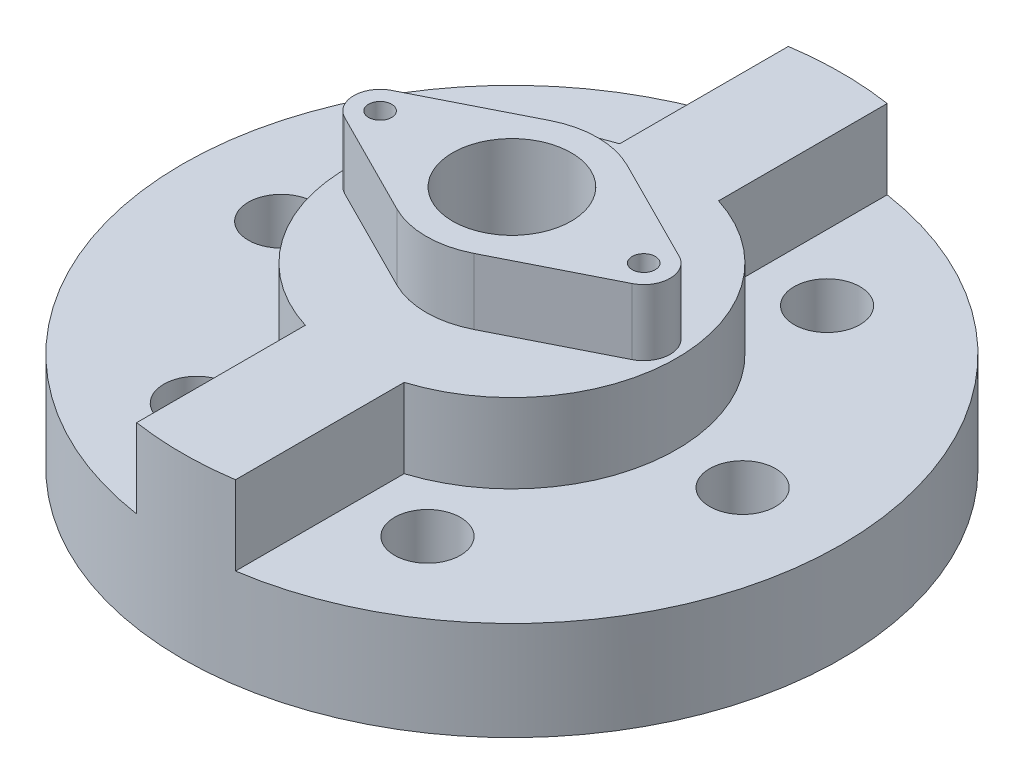
from build123d import *
from build123d.topology import SkipClean

# Parameters (mm, degrees)
SKETCH1_R           = 50
BOSS_EXTRUDE1_DEPTH = 15
BOSS_EXTRUDE2_DEPTH = 12
SKETCH3_R           = 1.75
BOSS_EXTRUDE3_DEPTH = 10
HOLE1_D             = 18
HOLE2_D             = 10
CIRPATTERN1_COUNT   = 6


with BuildPart() as part:
    # Sketch1 → Boss-Extrude1 (new body)
    with BuildSketch(Plane(origin=(0, 0, 0), x_dir=(1, 0, 0), z_dir=(0, 1, 0))):
        with Locations(Location((0, 0, 0), (0, 0, 270))):
            Circle(SKETCH1_R)
    extrude(amount=BOSS_EXTRUDE1_DEPTH)

    # Sketch2 → Boss-Extrude2 (add)
    with SkipClean():  # the faces are left unmerged after this step: merging them gives an invalid solid
        with BuildSketch(Plane(origin=(0, 15, 0), x_dir=(1, 0, 0), z_dir=(0, 1, 0))):
            with BuildLine():
                Line((7.5, 49.434299833), (7.5, 23.848480035))
                ThreePointArc((7.5, 23.848480035), (25, 0), (7.5, -23.848480035))
                Line((7.5, -23.848480035), (7.5, -49.434299833))
                ThreePointArc((7.5, -49.434299833), (0, -50), (-7.5, -49.434299833))
                Line((-7.5, -49.434299833), (-7.5, -23.848480035))
                ThreePointArc((-7.5, -23.848480035), (-25, 0), (-7.5, 23.848480035))
                Line((-7.5, 23.848480035), (-7.5, 49.434299833))
                ThreePointArc((-7.5, 49.434299833), (0, 50), (7.5, 49.434299833))
            make_face()
        extrude(amount=BOSS_EXTRUDE2_DEPTH)

    # Sketch3 → Boss-Extrude3 (add)
    with SkipClean():  # the faces are left unmerged after this step: merging them gives an invalid solid
        with BuildSketch(Plane(origin=(0, 27, 0), x_dir=(1, 0, 0), z_dir=(0, 1, 0))):
            with BuildLine():
                Line((-21.8, 3.57211422), (-5.85, 11.609371215))
                ThreePointArc((-5.85, 11.609371215), (0, 13), (5.85, 11.609371215))
                Line((5.85, 11.609371215), (21.8, 3.57211422))
                ThreePointArc((21.8, 3.57211422), (24, 0), (21.8, -3.57211422))
                Line((21.8, -3.57211422), (5.85, -11.609371215))
                ThreePointArc((5.85, -11.609371215), (0, -13), (-5.85, -11.609371215))
                Line((-5.85, -11.609371215), (-21.8, -3.57211422))
                ThreePointArc((-21.8, -3.57211422), (-24, 0), (-21.8, 3.57211422))
            make_face()
            with Locations(Location((-20, 0, 0), (0, 0, 270))):
                Circle(SKETCH3_R, mode=Mode.SUBTRACT)
            with Locations(Location((20, 0, 0), (0, 0, 270))):
                Circle(SKETCH3_R, mode=Mode.SUBTRACT)
        extrude(amount=BOSS_EXTRUDE3_DEPTH)

    # Hole1 (through all)
    with Locations(Plane(origin=(0, 37, 0), x_dir=(1, 0, 0), z_dir=(0, 1, 0))):
        with Locations((0, 0)):
            Hole(HOLE1_D / 2)

    # Hole2 (through all)
    with Locations(Plane(origin=(0, 15, 0), x_dir=(1, 0, 0), z_dir=(0, 1, 0))):
        with Locations((35, 0)):
            hole2 = Hole(HOLE2_D / 2)

    # CirPattern1: Hole2 ×6 about axis
    with SkipClean():  # the faces are left unmerged after this step: merging them gives an invalid solid
        cirpattern1_axis = Axis((0, 0, 0), (0, 1, 0))
        for i in range(1, CIRPATTERN1_COUNT):
            add(hole2.rotate(cirpattern1_axis, i * 360 / CIRPATTERN1_COUNT), mode=Mode.SUBTRACT)


solid = part.part
